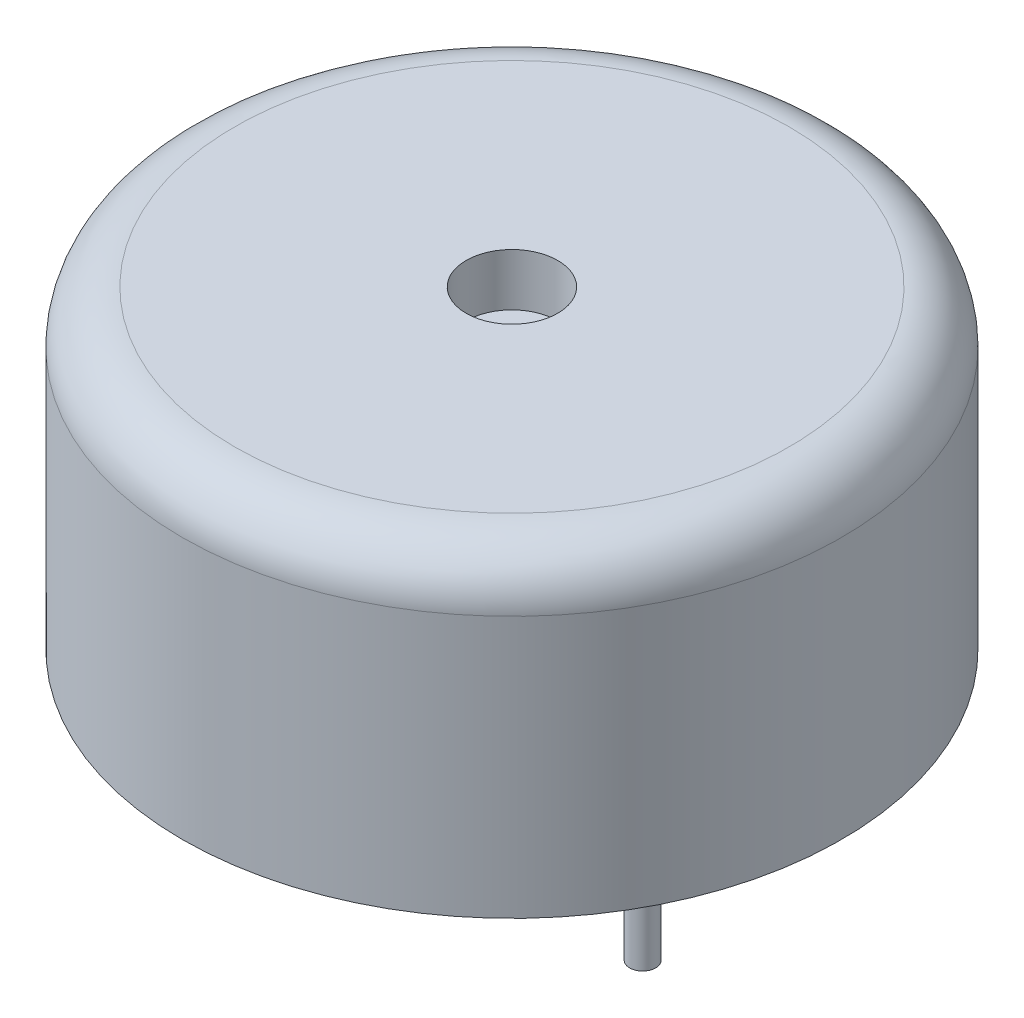
from build123d import *

# Parameters (mm, degrees)
SKETCH_1_R          = 6.3
SKETCH_1_R_2        = 1.25
SKETCH_1_R_3        = 0.5
SKETCH_1_R_4        = 0.25
SKETCH_1_R_5        = 0.875244423
EXTRUDE_1_DEPTH     = 6
FILLET_1_R          = 1
CUT_EXTRUDE_START   = 6
SKETCH_1_3_R        = 0.875244423
CUT_EXTRUDE_1_DEPTH = 1
SKETCH_1_4_R        = 1.25
SKETCH_1_4_R_2      = 0.25
SKETCH_1_4_R_3      = 0.5
EXTRUDE_2_DEPTH     = 0.9
FILLET_2_R          = 0.2
EXTRUDE_START       = -0.9
SKETCH_1_5_R        = 0.25
EXTRUDE_3_DEPTH     = 3


with BuildPart() as part:
    # Эскиз1 → Бобышка-Вытянуть1 (new body)
    # profile 1 of 8: a face of its own
    with BuildSketch(Plane(origin=(0, 0, 0), x_dir=(1, 0, 0), z_dir=(0, 1, 0))):
        with Locations(Location((0, 0, 0), (0, 0, 270))):
            Circle(SKETCH_1_R)
        with Locations((-2.5, 0)):
            Circle(SKETCH_1_R_2, mode=Mode.SUBTRACT)
        with Locations((2.5, 0)):
            Circle(SKETCH_1_R_2, mode=Mode.SUBTRACT)
        with Locations((0, 3.75)):
            Circle(SKETCH_1_R_3, mode=Mode.SUBTRACT)
        with Locations((0, -3.75)):
            Circle(SKETCH_1_R_3, mode=Mode.SUBTRACT)
    # profile 2 of 8: a face of its own
    with BuildSketch(Plane(origin=(0, 0, 0), x_dir=(1, 0, 0), z_dir=(0, 1, 0))):
        with Locations((-2.5, 0)):
            Circle(SKETCH_1_R_2)
        with Locations((-2.5, 0)):
            Circle(SKETCH_1_R_4, mode=Mode.SUBTRACT)
    # profile 3 of 8: a face of its own
    with BuildSketch(Plane(origin=(0, 0, 0), x_dir=(1, 0, 0), z_dir=(0, 1, 0))):
        with Locations((-2.5, 0)):
            Circle(SKETCH_1_R_4)
    # profile 4 of 8: a face of its own
    with BuildSketch(Plane(origin=(0, 0, 0), x_dir=(1, 0, 0), z_dir=(0, 1, 0))):
        with Locations((2.5, 0)):
            Circle(SKETCH_1_R_2)
        with Locations((2.5, 0)):
            Circle(SKETCH_1_R_4, mode=Mode.SUBTRACT)
    # profile 5 of 8: a face of its own
    with BuildSketch(Plane(origin=(0, 0, 0), x_dir=(1, 0, 0), z_dir=(0, 1, 0))):
        with Locations((2.5, 0)):
            Circle(SKETCH_1_R_4)
    # profile 6 of 8: a face of its own
    with BuildSketch(Plane(origin=(0, 0, 0), x_dir=(1, 0, 0), z_dir=(0, 1, 0))):
        with Locations((0, 3.75)):
            Circle(SKETCH_1_R_3)
    # profile 7 of 8: a face of its own
    with BuildSketch(Plane(origin=(0, 0, 0), x_dir=(1, 0, 0), z_dir=(0, 1, 0))):
        with Locations((0, -3.75)):
            Circle(SKETCH_1_R_3)
    # profile 8 of 8: a face of its own
    with BuildSketch(Plane(origin=(0, 0, 0), x_dir=(1, 0, 0), z_dir=(0, 1, 0))):
        Circle(SKETCH_1_R_5)
    extrude(amount=EXTRUDE_1_DEPTH)

    # Скругление1
    fillet_1_edges = [part.edges().sort_by_distance(p)[0] for p in [
        (0, 6, -6.3),
    ]]
    fillet(fillet_1_edges, radius=FILLET_1_R)

    # Эскиз1<3> → Вырез-Вытянуть1 (cut)
    with BuildSketch(Plane(origin=(0, 0, 0), x_dir=(1, 0, 0), z_dir=(0, 1, 0)).offset(CUT_EXTRUDE_START)):
        with Locations(Location((0, 0, 0), (0, 0, 270))):
            Circle(SKETCH_1_3_R)
    extrude(amount=-CUT_EXTRUDE_1_DEPTH, mode=Mode.SUBTRACT)

    # Эскиз1<4> → Бобышка-Вытянуть2 (add)
    # profile 1 of 6: a face of its own
    with BuildSketch(Plane(origin=(0, 0, 0), x_dir=(1, 0, 0), z_dir=(0, 1, 0))):
        with Locations(Location((-2.5, 0, 0), (0, 0, 270))):
            Circle(SKETCH_1_4_R)
        with Locations((-2.5, 0)):
            Circle(SKETCH_1_4_R_2, mode=Mode.SUBTRACT)
    # profile 2 of 6: a face of its own
    with BuildSketch(Plane(origin=(0, 0, 0), x_dir=(1, 0, 0), z_dir=(0, 1, 0))):
        with Locations(Location((0, -3.75, 0), (0, 0, 270))):
            Circle(SKETCH_1_4_R_3)
    # profile 3 of 6: a face of its own
    with BuildSketch(Plane(origin=(0, 0, 0), x_dir=(1, 0, 0), z_dir=(0, 1, 0))):
        with Locations(Location((2.5, 0, 0), (0, 0, 270))):
            Circle(SKETCH_1_4_R)
        with Locations((2.5, 0)):
            Circle(SKETCH_1_4_R_2, mode=Mode.SUBTRACT)
    # profile 4 of 6: a face of its own
    with BuildSketch(Plane(origin=(0, 0, 0), x_dir=(1, 0, 0), z_dir=(0, 1, 0))):
        with Locations((2.5, 0)):
            Circle(SKETCH_1_4_R_2)
    # profile 5 of 6: a face of its own
    with BuildSketch(Plane(origin=(0, 0, 0), x_dir=(1, 0, 0), z_dir=(0, 1, 0))):
        with Locations((-2.5, 0)):
            Circle(SKETCH_1_4_R_2)
    # profile 6 of 6: a face of its own
    with BuildSketch(Plane(origin=(0, 0, 0), x_dir=(1, 0, 0), z_dir=(0, 1, 0))):
        with Locations(Location((0, 3.75, 0), (0, 0, 270))):
            Circle(SKETCH_1_4_R_3)
    extrude(amount=-EXTRUDE_2_DEPTH)

    # Скругление2
    fillet_2_edges = [part.edges().sort_by_distance(p)[0] for p in [
        (2.5, -0.9, -1.25),
        (-2.5, -0.9, -1.25),
    ]]
    fillet(fillet_2_edges, radius=FILLET_2_R)

    # Эскиз1<5> → Бобышка-Вытянуть3 (add)
    with BuildSketch(Plane(origin=(0, 0, 0), x_dir=(1, 0, 0), z_dir=(0, 1, 0)).offset(EXTRUDE_START)):
        with Locations(Location((-2.5, 0, 0), (0, 0, 270))):
            Circle(SKETCH_1_5_R)
        with Locations(Location((2.5, 0, 0), (0, 0, 270))):
            Circle(SKETCH_1_5_R)
    extrude(amount=-EXTRUDE_3_DEPTH)


solid = part.part
